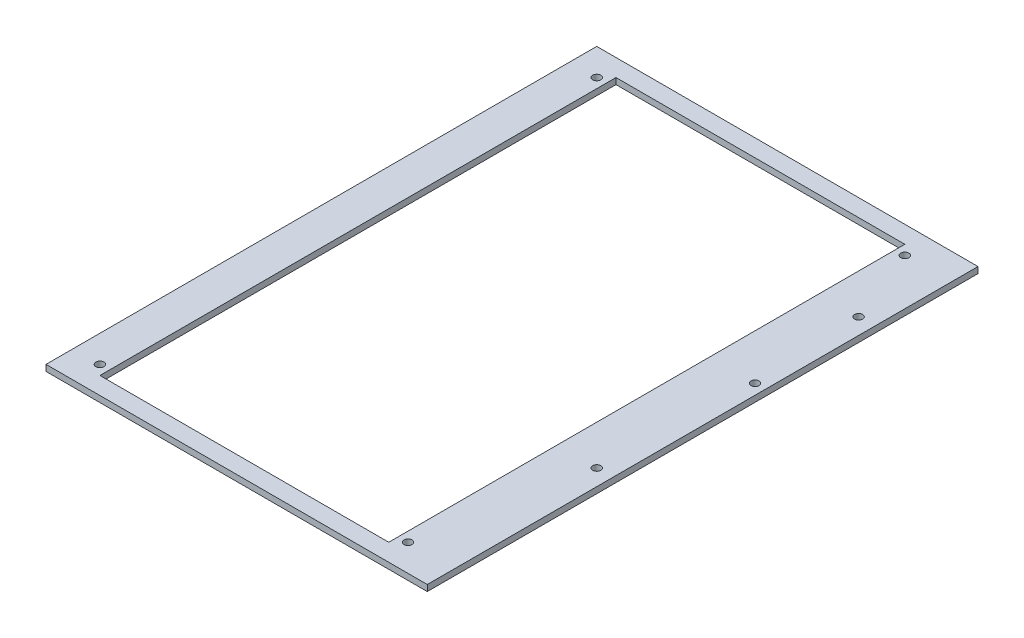
from build123d import *

# Parameters (mm, degrees)
SKETCH_1_W      = 99
SKETCH_1_H      = 143
SKETCH_1_W_2    = 75
SKETCH_1_H_2    = 134
SKETCH_1_R      = 1.05
EXTRUDE_1_DEPTH = 1.6


with BuildPart() as part:
    # 草图1 → 凸台-拉伸1 (new body)
    with BuildSketch(Plane(origin=(0, 0, 0), x_dir=(1, 0, 0), z_dir=(0, 1, 0))):
        with Locations((49.5, -71.5)):
            Rectangle(SKETCH_1_W, SKETCH_1_H)
        with Locations((47, -71.5)):
            Rectangle(SKETCH_1_W_2, SKETCH_1_H_2, mode=Mode.SUBTRACT)
        with Locations(Location((94.8, -94.8, 0), (0, 0, 270))):
            Circle(SKETCH_1_R, mode=Mode.SUBTRACT)
        with Locations(Location((7, -7, 0), (0, 0, 270))):
            Circle(SKETCH_1_R, mode=Mode.SUBTRACT)
        with Locations(Location((96.3, -55.2, 0), (0, 0, 270))):
            Circle(SKETCH_1_R, mode=Mode.SUBTRACT)
        with Locations(Location((94.8, -26.8, 0), (0, 0, 270))):
            Circle(SKETCH_1_R, mode=Mode.SUBTRACT)
        with Locations(Location((87, -7, 0), (0, 0, 270))):
            Circle(SKETCH_1_R, mode=Mode.SUBTRACT)
        with Locations(Location((7, -136, 0), (0, 0, 270))):
            Circle(SKETCH_1_R, mode=Mode.SUBTRACT)
        with Locations(Location((87, -136, 0), (0, 0, 270))):
            Circle(SKETCH_1_R, mode=Mode.SUBTRACT)
    extrude(amount=EXTRUDE_1_DEPTH)


solid = part.part
